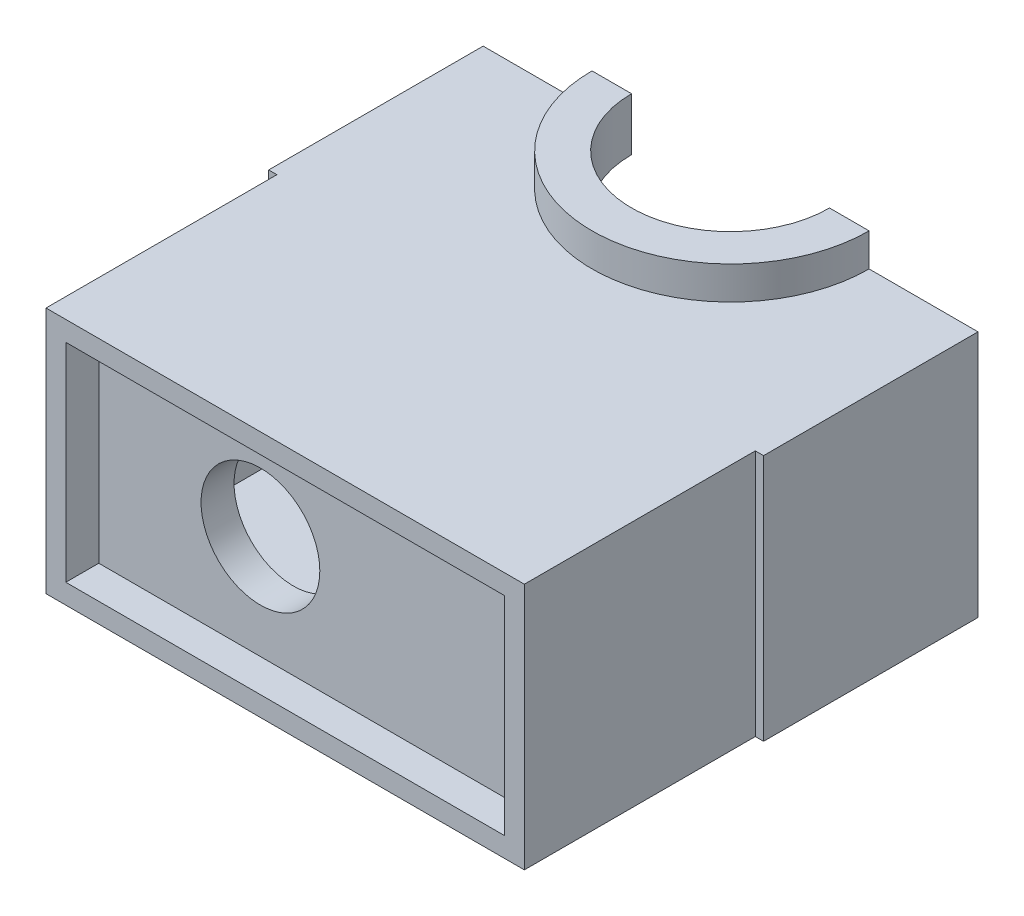
from build123d import *

# Parameters (mm, degrees)
SKETCH_5_W          = 13.3
SKETCH_5_H          = 6.3
SKETCH_5_R          = 1.8
EXTRUDE_2_DEPTH     = 1
SKETCH_5_3_W        = 14.5
SKETCH_5_3_H        = 7.5
SKETCH_5_3_W_2      = 13.3
SKETCH_5_3_H_2      = 6.3
EXTRUDE_3_DEPTH     = 2
SKETCH_5_4_W        = 14.5
SKETCH_5_4_H        = 7.5
SKETCH_5_4_W_2      = 13.3
SKETCH_5_4_H_2      = 6.3
EXTRUDE_4_DEPTH     = 5
SKETCH_8_W          = 15
SKETCH_8_H          = 7.5
SKETCH_8_W_2        = 13.8
SKETCH_8_H_2        = 6.3
EXTRUDE_5_DEPTH     = 6.5
EXTRUDE_6_DEPTH     = 1
EXTRUDE_START       = 1
EXTRUDE_7_DEPTH     = 1
CUT_EXTRUDE_1_DEPTH = 18.03122133


with BuildPart() as part:
    # 草图5 → 凸台-拉伸2 (new body)
    with BuildSketch(Plane.XY):
        with Locations((1.75, 0)):
            Rectangle(SKETCH_5_W, SKETCH_5_H)
        Circle(SKETCH_5_R, mode=Mode.SUBTRACT)
    extrude(amount=EXTRUDE_2_DEPTH)

    # 草图5<3> → 凸台-拉伸3 (add)
    with BuildSketch(Plane.XY):
        with Locations((1.75, 0)):
            Rectangle(SKETCH_5_3_W, SKETCH_5_3_H)
        with Locations((1.75, 0)):
            Rectangle(SKETCH_5_3_W_2, SKETCH_5_3_H_2, mode=Mode.SUBTRACT)
    extrude(amount=EXTRUDE_3_DEPTH)

    # 草图5<4> → 凸台-拉伸4 (add)
    with BuildSketch(Plane.XY):
        with Locations((1.75, 0)):
            Rectangle(SKETCH_5_4_W, SKETCH_5_4_H)
        with Locations((1.75, 0)):
            Rectangle(SKETCH_5_4_W_2, SKETCH_5_4_H_2, mode=Mode.SUBTRACT)
    extrude(amount=-EXTRUDE_4_DEPTH)

    # 草图8 → 凸台-拉伸5 (add)
    with BuildSketch(Plane(origin=(0, 0, -5), x_dir=(-1, 0, 0), z_dir=(0, 0, -1))):
        with Locations((-1.75, 0)):
            Rectangle(SKETCH_8_W, SKETCH_8_H)
        with Locations((-1.75, 0)):
            Rectangle(SKETCH_8_W_2, SKETCH_8_H_2, mode=Mode.SUBTRACT)
    extrude(amount=EXTRUDE_5_DEPTH)

    # 草图9 → 凸台-拉伸6 (add)
    with BuildSketch(Plane(origin=(0, 3.75, 0), x_dir=(1, 0, 0), z_dir=(0, 1, 0))):
        with BuildLine():
            Line((5.95, 11.5), (4.75, 11.5))
            ThreePointArc((4.75, 11.5), (1.75, 8.5), (-1.25, 11.5))
            Line((-1.25, 11.5), (-2.45, 11.5))
            ThreePointArc((-2.45, 11.5), (1.75, 7.3), (5.95, 11.5))
        make_face()
    extrude(amount=EXTRUDE_6_DEPTH)

    # 草图11 → 凸台-拉伸7 (add)
    with BuildSketch(Plane.XZ.offset(3.75).offset(EXTRUDE_START)):
        with BuildLine():
            Line((4.75, -11.5), (5.95, -11.5))
            ThreePointArc((5.95, -11.5), (1.75, -7.3), (-2.45, -11.5))
            Line((-2.45, -11.5), (-1.25, -11.5))
            ThreePointArc((-1.25, -11.5), (1.75, -8.5), (4.75, -11.5))
        make_face()
    extrude(amount=-EXTRUDE_7_DEPTH)

    # 草图12 → 切除-拉伸1 (cut, through all)
    with BuildSketch(Plane.XZ.offset(3.75)):
        with BuildLine():
            Line((4.75, -11.5), (-1.25, -11.5))
            ThreePointArc((-1.25, -11.5), (1.75, -8.5), (4.75, -11.5))
        make_face()
    extrude(amount=-CUT_EXTRUDE_1_DEPTH, mode=Mode.SUBTRACT)


solid = part.part
